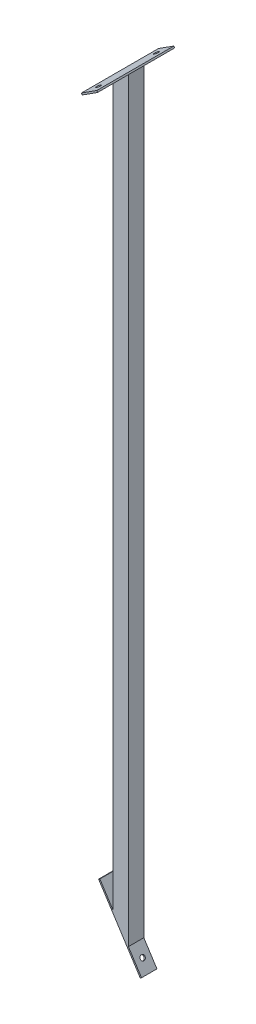
from build123d import *

# Parameters (mm, degrees)
SKETCH15_W                                    = 20
SKETCH15_H                                    = 20
SKETCH15_W_2                                  = 16
SKETCH15_H_2                                  = 16
AL_TUBE_SQUARE_AL_TUBE_0_75_SQR_X_0_065_DEPTH = 988.9
SKETCH16_R                                    = 5
CUT_EXTRUDE1_DEPTH                            = 990.152773842
CUT_EXTRUDE3_DEPTH                            = 990.152773842
CUT_EXTRUDE4_DEPTH                            = 990.152773842
CUT_EXTRUDE4_DEPTH_BACK                       = 990.152773842
SKETCH19_W                                    = 20
SKETCH19_H                                    = 100
BOSS_EXTRUDE1_DEPTH                           = 2
SKETCH20_W                                    = 23.776793386
SKETCH20_H                                    = 100
BOSS_EXTRUDE2_DEPTH                           = 2
SKETCH22_R                                    = 3.125
CUT_EXTRUDE5_DEPTH                            = 2
SKETCH23_R                                    = 3.125
CUT_EXTRUDE6_DEPTH                            = 2


with BuildPart() as part:
    # Sketch15 → Al tube square AL TUBE 0.75 SQR X 0.065 WALL(1) (new body)
    with BuildSketch(Plane(origin=(0, 0, 0), x_dir=(-1, 0, 0), z_dir=(0, 1, 0))):
        Rectangle(SKETCH15_W, SKETCH15_H)
        Rectangle(SKETCH15_W_2, SKETCH15_H_2, mode=Mode.SUBTRACT)
    extrude(amount=AL_TUBE_SQUARE_AL_TUBE_0_75_SQR_X_0_065_DEPTH)

    # Sketch16 → Cut-Extrude1 (cut, through all)
    with BuildSketch(Plane.XY.offset(10)):
        with Locations((0, 10)):
            Circle(SKETCH16_R)
    extrude(amount=-CUT_EXTRUDE1_DEPTH, mode=Mode.SUBTRACT)

    # Sketch17 → Cut-Extrude3 (cut, through all)
    with BuildSketch(Plane.XY.offset(10)):
        Polygon((10, 988.9), (-10, 976.041699033), (-10, 988.9), align=None)
    extrude(amount=-CUT_EXTRUDE3_DEPTH, mode=Mode.SUBTRACT)

    # Sketch18 → Cut-Extrude4 (cut, two sides: drawn at the far end of the back side and taken through both)
    with BuildSketch(Plane(origin=(0, 0, -10), x_dir=(-1, 0, 0), z_dir=(0, 0, -1)).offset(-CUT_EXTRUDE4_DEPTH_BACK)):
        Polygon((-15.481315588, 0.33029398), (41.362305483, 88.745740497), (41.362305483, -42.243020437), (-15.481315588, -42.243020437), align=None)
    extrude(amount=CUT_EXTRUDE4_DEPTH + CUT_EXTRUDE4_DEPTH_BACK, mode=Mode.SUBTRACT)

    # Sketch19 → Boss-Extrude1 (add)
    with BuildSketch(Plane(origin=(11.103958871, 7.138902254, 0), x_dir=(0, 0, 1), z_dir=(-0.8411563188826338, -0.5407920554185471, 0))):
        with Locations((0, 20.532769961)):
            Rectangle(SKETCH19_W, SKETCH19_H)
    extrude(amount=BOSS_EXTRUDE1_DEPTH)

    # Sketch20 → Boss-Extrude2 (add)
    with BuildSketch(Plane(origin=(-446.916807879, 695.141308374, 0), x_dir=(0.8411563188826335, 0.5407920554185475, 0), z_dir=(-0.5407920554185475, 0.8411563188826335, 0))):
        with Locations((531.312430099, 0)):
            Rectangle(SKETCH20_W, SKETCH20_H)
    extrude(amount=BOSS_EXTRUDE2_DEPTH)

    # Sketch22 → Cut-Extrude5 (cut)
    with BuildSketch(Plane(origin=(-447.998391989, 696.823621012, 0), x_dir=(0.8411563188826324, 0.5407920554185492, 0), z_dir=(-0.5407920554185492, 0.8411563188826324, 0))):
        with Locations(Location((531.312430099, 37.5, 0), (0, 0, 180))):
            Circle(SKETCH22_R)
        with Locations(Location((531.312430099, -37.5, 0), (0, 0, 180))):
            Circle(SKETCH22_R)
    extrude(amount=-CUT_EXTRUDE5_DEPTH, mode=Mode.SUBTRACT)

    # Sketch23 → Cut-Extrude6 (cut)
    with BuildSketch(Plane(origin=(11.103958871, 7.138902254, 0), x_dir=(0, 0, -1), z_dir=(0.8411563188826338, 0.540792055418547, 0))):
        with Locations(Location((0, -13.712927992, 0), (0, 0, 90))):
            Circle(SKETCH23_R)
    extrude(amount=-CUT_EXTRUDE6_DEPTH, mode=Mode.SUBTRACT)


solid = part.part
